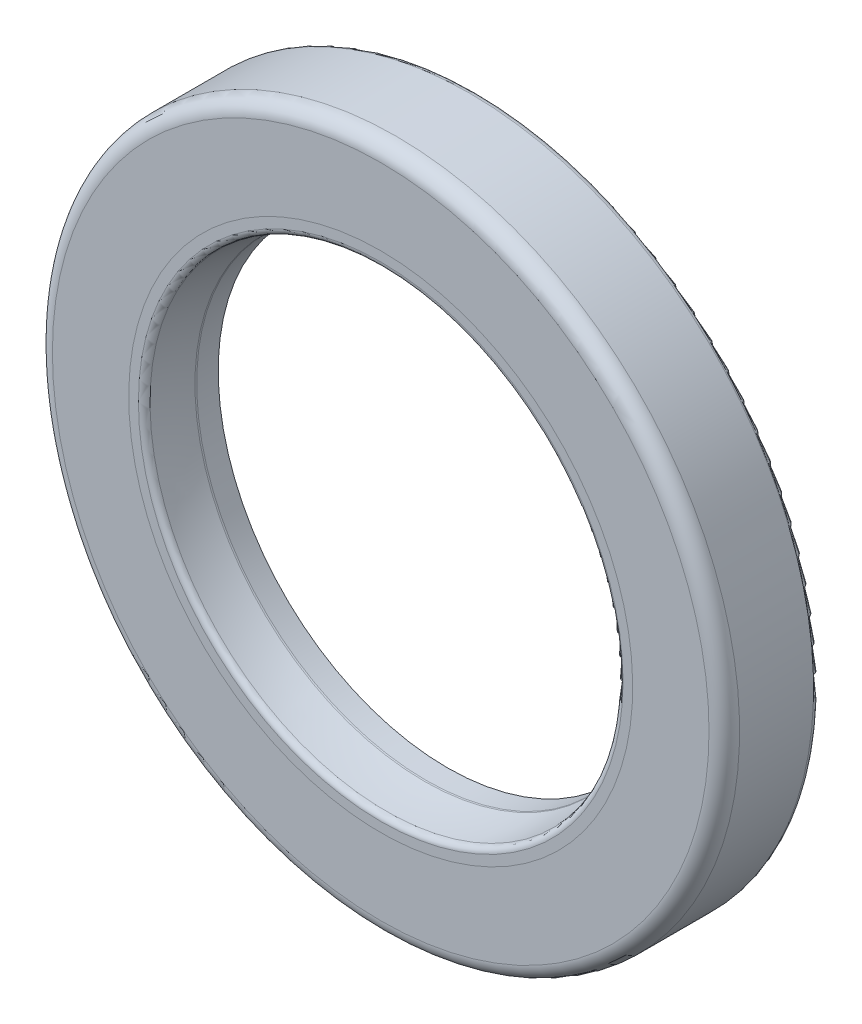
from build123d import *


with BuildPart() as part:
    # Sketch2 → Revolve1 (revolve)
    with BuildSketch(Plane(origin=(0, 0, 0), x_dir=(0, 0, -1), z_dir=(1, 0, 0))):
        with BuildLine():
            Line((-2.1717, 10.469011515), (-2.1717, 13.6398))
            ThreePointArc((-2.1717, 13.6398), (-1.985712806, 14.088812806), (-1.5367, 14.2748))
            Line((-1.5367, 14.2748), (1.5367, 14.2748))
            ThreePointArc((1.5367, 14.2748), (1.716305122, 14.200405122), (1.7907, 14.0208))
            Line((1.7907, 14.0208), (1.7907, 13.5128))
            Line((1.7907, 13.5128), (1.5367, 13.5128))
            Line((1.5367, 13.5128), (1.5367, 13.7668))
            ThreePointArc((1.5367, 13.7668), (1.2827, 14.0208), (1.0287, 13.7668))
            Line((1.0287, 13.7668), (-1.6002, 13.7668))
            ThreePointArc((-1.6002, 13.7668), (-1.645101281, 13.748201281), (-1.6637, 13.7033))
            Line((-1.6637, 13.7033), (-1.6637, 10.469011515))
            Line((-1.6637, 10.469011515), (-2.1717, 10.469011515))
        make_face()
    revolve(axis=Axis((0, 0, 1.6637), (0, 0, 1)))


with BuildPart() as body_2:
    # Sketch3 → Revolve2 (revolve)
    with BuildSketch(Plane(origin=(0, 0, 0), x_dir=(0, 0, -1), z_dir=(1, 0, 0))):
        with BuildLine():
            Line((0.60198, 9.525), (-0.292368083, 9.525))
            ThreePointArc((-0.292368083, 9.525), (-0.324651771, 9.52706), (-0.356411802, 9.533206586))
            ThreePointArc((-0.356411802, 9.533206586), (-1.143674906, 9.705309345), (-1.942101476, 9.814476951))
            ThreePointArc((-1.942101476, 9.814476951), (-2.105734538, 9.896542022), (-2.1717, 10.067302124))
            Line((-2.1717, 10.067302124), (-2.1717, 10.469011515))
            Line((-2.1717, 10.469011515), (-1.6637, 10.469011515))
            Line((-1.6637, 10.469011515), (-1.6637, 10.831244803))
            ThreePointArc((-1.6637, 10.831244803), (-0.626121629, 10.692474816), (0.402267523, 10.496919873))
            ThreePointArc((0.402267523, 10.496919873), (0.545849946, 10.408048306), (0.60198, 10.248789131))
            Line((0.60198, 10.248789131), (0.60198, 9.525))
        make_face()
    revolve(axis=Axis((0, 0, 1.6637), (0, 0, 1)))


solid = Compound([part.part, body_2.part])
